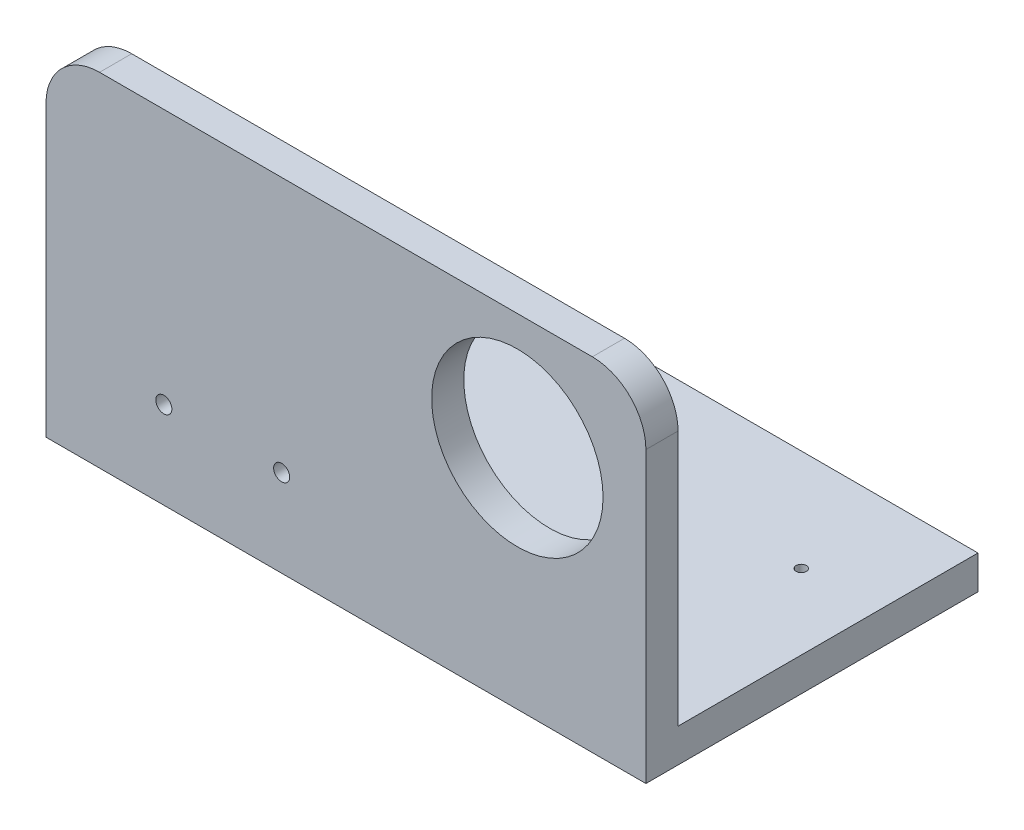
from build123d import *

# Parameters (mm, degrees)
SKETCH1_W           = 355.6
SKETCH1_H           = 177.8
SKETCH1_R           = 3.048
BOSS_EXTRUDE1_DEPTH = 19.939
SKETCH2_W           = 355.6
SKETCH2_H           = 19.05
BOSS_EXTRUDE2_DEPTH = 203.2
SKETCH3_R           = 50.8
SKETCH3_R_2         = 4.7625
CUT_EXTRUDE1_DEPTH  = 455.413382835
FILLET1_R           = 31.75


with BuildPart() as part:
    # Sketch1 → Boss-Extrude1 (new body)
    with BuildSketch(Plane(origin=(0, 0, 0), x_dir=(1, 0, 0), z_dir=(0, 1, 0))):
        with Locations((177.8, 88.9)):
            Rectangle(SKETCH1_W, SKETCH1_H)
        with Locations(Location((95.25, 117.475, 0), (0, 0, 270))):
            Circle(SKETCH1_R, mode=Mode.SUBTRACT)
        with Locations(Location((311.15, 117.475, 0), (0, 0, 270))):
            Circle(SKETCH1_R, mode=Mode.SUBTRACT)
        with Locations(Location((311.15, 31.75, 0), (0, 0, 270))):
            Circle(SKETCH1_R, mode=Mode.SUBTRACT)
        with Locations(Location((95.25, 31.75, 0), (0, 0, 270))):
            Circle(SKETCH1_R, mode=Mode.SUBTRACT)
    extrude(amount=BOSS_EXTRUDE1_DEPTH)

    # Sketch2 → Boss-Extrude2 (add)
    with BuildSketch(Plane(origin=(0, 0, 0), x_dir=(1, 0, 0), z_dir=(0, 1, 0))):
        with Locations((177.8, -9.525)):
            Rectangle(SKETCH2_W, SKETCH2_H)
    extrude(amount=BOSS_EXTRUDE2_DEPTH)

    # Sketch3 → Cut-Extrude1 (cut, through all)
    with BuildSketch(Plane.XY.offset(19.05)):
        with Locations((279.4, 134.239)):
            Circle(SKETCH3_R)
        with Locations((69.85, 51.689)):
            Circle(SKETCH3_R_2)
        with Locations((139.7, 51.689)):
            Circle(SKETCH3_R_2)
    extrude(amount=-CUT_EXTRUDE1_DEPTH, mode=Mode.SUBTRACT)

    # Fillet1
    fillet1_edges = [part.edges().sort_by_distance(p)[0] for p in [
        (355.6, 203.2, 9.525),
        (0, 203.2, 9.525),
    ]]
    fillet(fillet1_edges, radius=FILLET1_R)


solid = part.part
